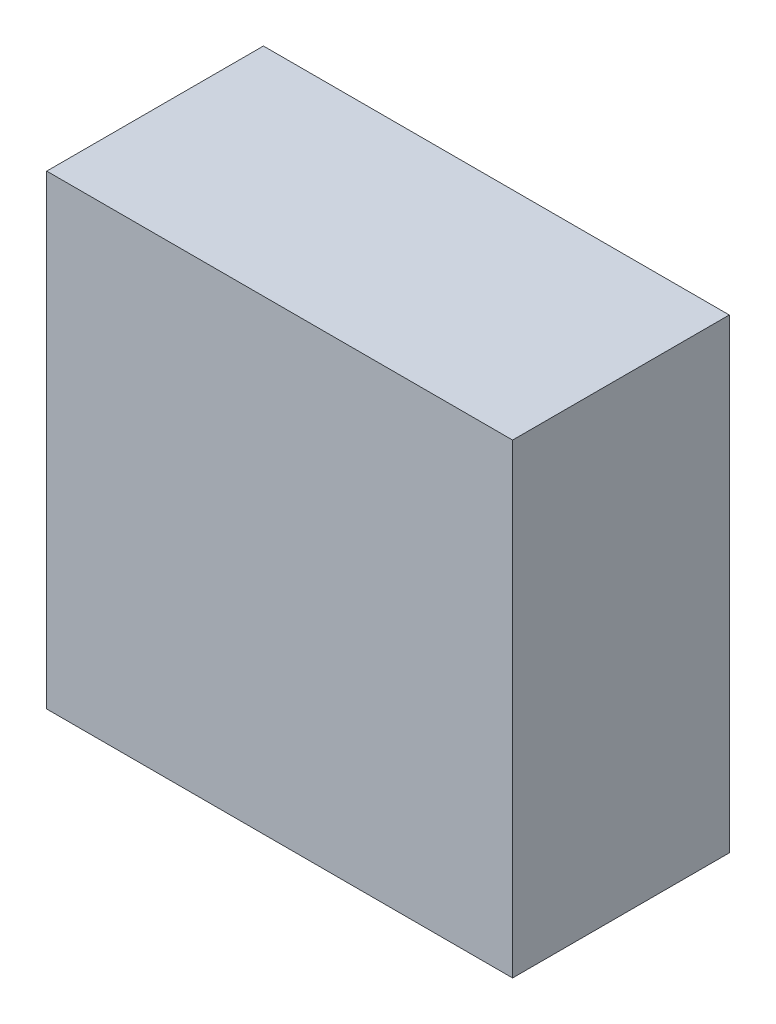
from build123d import *

# Parameters (mm, degrees)
ESBO_O1_W                = 43
ESBO_O1_H                = 43
RESSALTO_EXTRUS_O1_DEPTH = 20


with BuildPart() as part:
    # Esboço1 → Ressalto-extrusão1 (new body)
    with BuildSketch(Plane.XY):
        Rectangle(ESBO_O1_W, ESBO_O1_H)
    extrude(amount=RESSALTO_EXTRUS_O1_DEPTH)


solid = part.part
